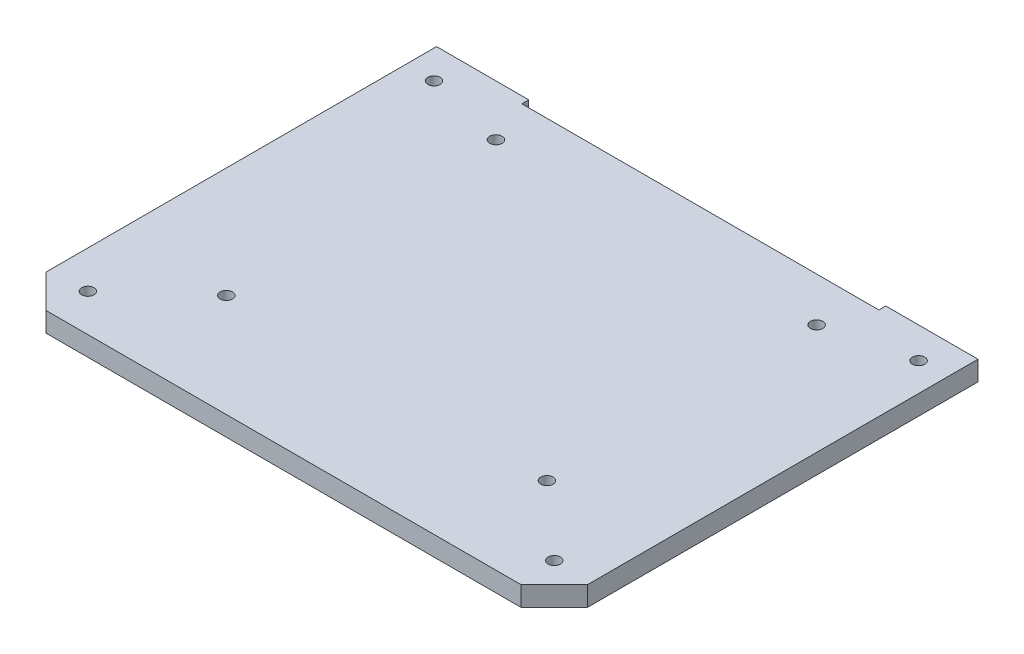
from build123d import *

# Parameters (mm, degrees)
LID_PLATE_DEPTH     = 2.4
DRIP_SKIRT_DEPTH    = 3.01
SKETCH3_W           = 25.3
SKETCH3_H           = 1.9
FRONT_SKIRT_L_DEPTH = 5.4
SKETCH4_W           = 25.3
SKETCH4_H           = 1.9
FRONT_SKIRT_R_DEPTH = 5.4
SKETCH5_R           = 1.7
SCREW_HOLES_DEPTH   = 4.4


with BuildPart() as part:
    # Sketch1 → Lid Plate (new body)
    with BuildSketch(Plane(origin=(0, 28, 0), x_dir=(1, 0, 0), z_dir=(0, 1, 0))):
        Polygon((-65.187005769, -126.3), (65.187005769, -126.3), (74.3, -117.187005769), (74.3, -11.9), (-74.3, -11.9), (-74.3, -117.187005769), align=None)
    extrude(amount=LID_PLATE_DEPTH)

    # Sketch2 → Drip Skirt (add)
    with BuildSketch(Plane(origin=(0, 25, 0), x_dir=(1, 0, 0), z_dir=(0, 1, 0))):
        Polygon((74.3, -11.9), (74.3, -117.187005769), (65.187005769, -126.3), (-65.187005769, -126.3), (-74.3, -117.187005769), (-74.3, -11.9), (-72.7, -11.9), (-72.7, -116.524264069), (-64.524264069, -124.7), (64.524264069, -124.7), (72.7, -116.524264069), (72.7, -11.9), align=None)
    extrude(amount=DRIP_SKIRT_DEPTH)

    # Sketch3 → Front Skirt L (add)
    with BuildSketch(Plane(origin=(0, 25, 0), x_dir=(1, 0, 0), z_dir=(0, 1, 0))):
        with Locations((-61.65, -10.95)):
            Rectangle(SKETCH3_W, SKETCH3_H)
    extrude(amount=FRONT_SKIRT_L_DEPTH)

    # Sketch4 → Front Skirt R (add)
    with BuildSketch(Plane(origin=(0, 25, 0), x_dir=(1, 0, 0), z_dir=(0, 1, 0))):
        with Locations((61.65, -10.95)):
            Rectangle(SKETCH4_W, SKETCH4_H)
    extrude(amount=FRONT_SKIRT_R_DEPTH)

    # Sketch5 → Screw Holes (cut)
    with BuildSketch(Plane(origin=(0, 27, 0), x_dir=(1, 0, 0), z_dir=(0, 1, 0))):
        with Locations(Location((-66.5, -18.5, 0), (0, 0, 270))):
            Circle(SKETCH5_R)
        with Locations(Location((66.5, -18.5, 0), (0, 0, 270))):
            Circle(SKETCH5_R)
        with Locations(Location((-64, -116, 0), (0, 0, 270))):
            Circle(SKETCH5_R)
        with Locations(Location((64, -116, 0), (0, 0, 270))):
            Circle(SKETCH5_R)
        with Locations(Location((-44, -24, 0), (0, 0, 270))):
            Circle(SKETCH5_R)
        with Locations(Location((-44, -98, 0), (0, 0, 270))):
            Circle(SKETCH5_R)
        with Locations(Location((44, -24, 0), (0, 0, 270))):
            Circle(SKETCH5_R)
        with Locations(Location((44, -98, 0), (0, 0, 270))):
            Circle(SKETCH5_R)
    extrude(amount=SCREW_HOLES_DEPTH, mode=Mode.SUBTRACT)


solid = part.part
